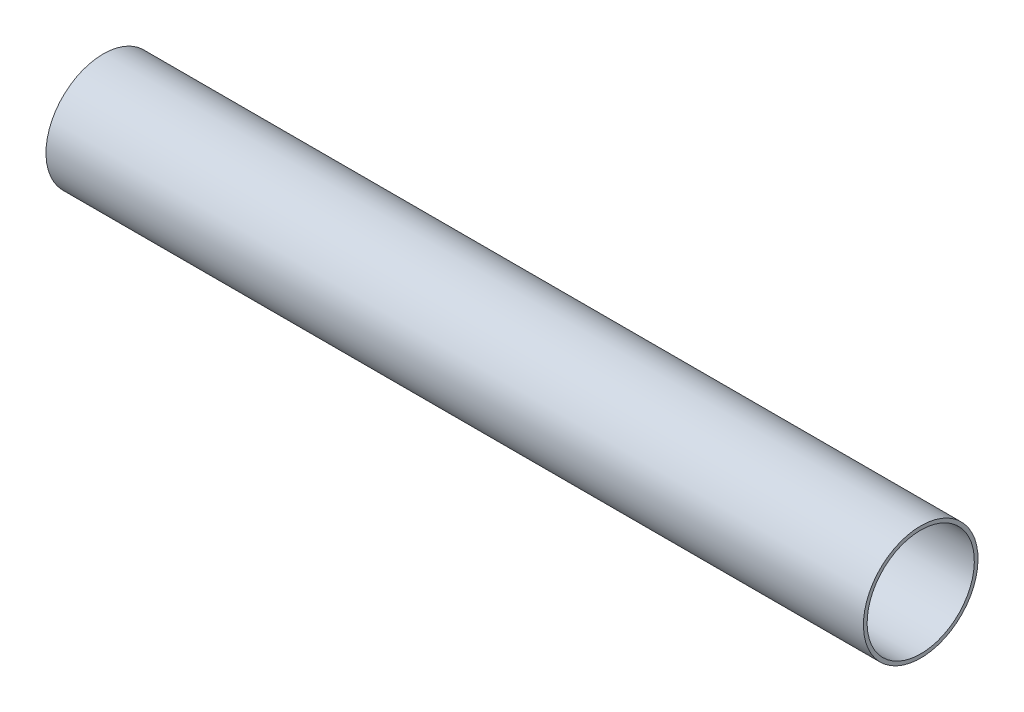
from build123d import *

# Parameters (mm, degrees)
SKETCH1_W = 702.056
SKETCH1_H = 3.175


with BuildPart() as part:
    # Sketch1 → Revolve1 (revolve)
    with BuildSketch(Plane.XY):
        with Locations((-351.028, 47.625)):
            Rectangle(SKETCH1_W, SKETCH1_H)
    revolve(axis=Axis((0, 0, 0), (-1, 0, 0)))


solid = part.part
